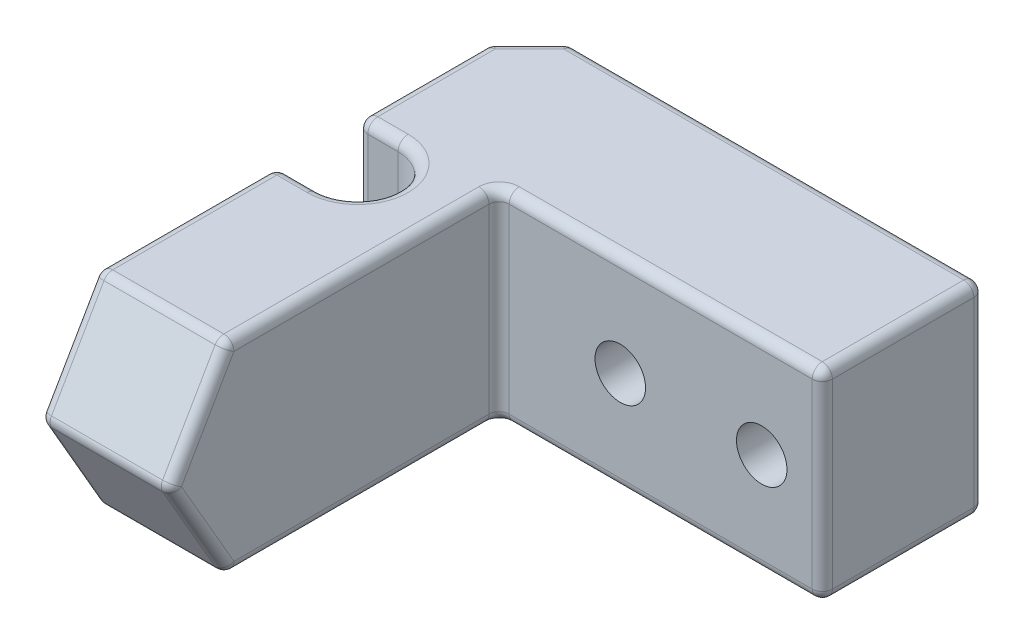
from build123d import *

# Parameters (mm, degrees)
ESQUISSE1_W             = 22.5
ESQUISSE1_H             = 10
BOSS_EXTRU_1_DEPTH      = 8
CHANFREIN1_SIZE         = 2
BOSS_EXTRU_3_DEPTH      = 6.5
ENL_V_MAT_EXTRU_1_DEPTH = 7
TROU_TARAUD_M33_D       = 2.5
CONG_1_R                = 0.5


with BuildPart() as part:
    # Esquisse1 → Boss.-Extru.1 (new body)
    with BuildSketch(Plane.XY):
        with Locations((11.25, 5)):
            Rectangle(ESQUISSE1_W, ESQUISSE1_H)
    extrude(amount=BOSS_EXTRU_1_DEPTH)

    # Chanfrein1
    chanfrein1_edges = [part.edges().sort_by_distance(p)[0] for p in [
        (0, 5, 0),
    ]]
    chamfer(chanfrein1_edges, length=CHANFREIN1_SIZE)

    # Esquisse3 → Boss.-Extru.3 (add)
    with BuildSketch(Plane.ZY):
        Polygon((8, 10), (21.413248654, 10), (24.3, 5), (21.413248654, 0), (8, 0), (2, 0), (2, 10), align=None)
    extrude(amount=-BOSS_EXTRU_3_DEPTH)

    # Esquisse4 → Enlèv. mat.-Extru.1 (cut)
    with BuildSketch(Plane(origin=(0, 10, 0), x_dir=(1, 0, 0), z_dir=(0, 1, 0))):
        with BuildLine():
            Line((0, -8.5), (2, -8.5))
            ThreePointArc((2, -8.5), (4, -10.5), (2, -12.5))
            Line((2, -12.5), (0, -12.5))
            Line((0, -12.5), (0, -8.5))
        make_face()
    extrude(amount=-ENL_V_MAT_EXTRU_1_DEPTH, mode=Mode.SUBTRACT)

    # Trou taraudé M33 (through all)
    with Locations(Plane(origin=(19.5, 5, 0), x_dir=(-1, 0, 0), z_dir=(0, 0, -1))):
        with Locations((0, 0), (7, 0)):
            Hole(TROU_TARAUD_M33_D / 2)

    # Congé1
    cong_1_edges = [part.edges().sort_by_distance(p)[0] for p in [
        (0, 10, 5.25),
        (3.25, 5, 24.3),
        (3.25, 0, 21.413248654),
        (14.5, 0, 8),
        (12.25, 0, 0),
        (1, 0, 1),
        (2, 5, 0),
        (1, 3, 8.5),
        (4, 3, 10.5),
        (1, 3, 12.5),
        (22.5, 0, 4),
        (22.5, 5, 8),
        (22.5, 5, 0),
        (6.5, 2.5, 22.856624327),
        (6.5, 7.5, 22.856624327),
        (6.5, 5, 8),
        (6.5, 0, 14.706624327),
        (1, 10, 1),
        (12.25, 10, 0),
        (22.5, 10, 4),
        (14.5, 10, 8),
        (6.5, 10, 14.706624327),
        (3.25, 10, 21.413248654),
        (1, 10, 12.5),
        (4, 10, 10.5),
        (1, 10, 8.5),
        (0, 6.5, 12.5),
        (0, 10, 16.956624327),
        (0, 7.5, 22.856624327),
        (0, 2.5, 22.856624327),
        (0, 0, 11.706624327),
        (0, 5, 2),
        (0, 6.5, 8.5),
        (0, 3, 10.5),
    ]]
    fillet(cong_1_edges, radius=CONG_1_R)


solid = part.part
